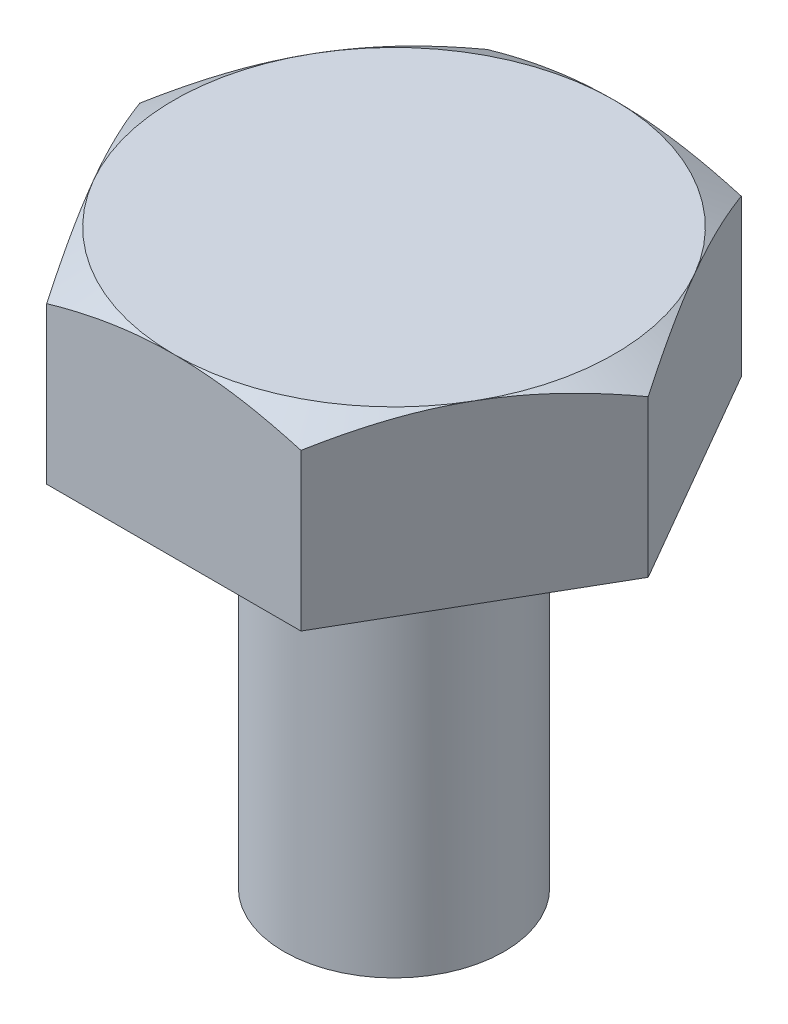
from build123d import *

# Parameters (mm, degrees)
BOSS_EXTRUDE1_DEPTH = 4
SKETCH4_R           = 2.5
BOSS_EXTRUDE2_DEPTH = 9


with BuildPart() as part:
    # Sketch1 → Boss-Extrude1 (new body)
    with BuildSketch(Plane(origin=(0, 0, 0), x_dir=(1, 0, 0), z_dir=(0, 1, 0))):
        Polygon((5.773502692, 0), (2.886751346, 5), (-2.886751346, 5), (-5.773502692, 0), (-2.886751346, -5), (2.886751346, -5), align=None)
    extrude(amount=-BOSS_EXTRUDE1_DEPTH)

    # Sketch3 → Cut-Revolve1 (revolve, cut)
    with BuildSketch(Plane.XY):
        Polygon((5.000002459, 0), (5.773502692, 0), (5.773502692, -0.446580568), align=None)
    revolve(axis=Axis((0, 1.337001122, 0), (0, -1, 0)), mode=Mode.SUBTRACT)

    # Sketch4 → Boss-Extrude2 (add)
    with BuildSketch(Plane.XZ.offset(4)):
        with Locations(Location((0, 0, 0), (0, 0, 90))):
            Circle(SKETCH4_R)
    extrude(amount=BOSS_EXTRUDE2_DEPTH)


solid = part.part
